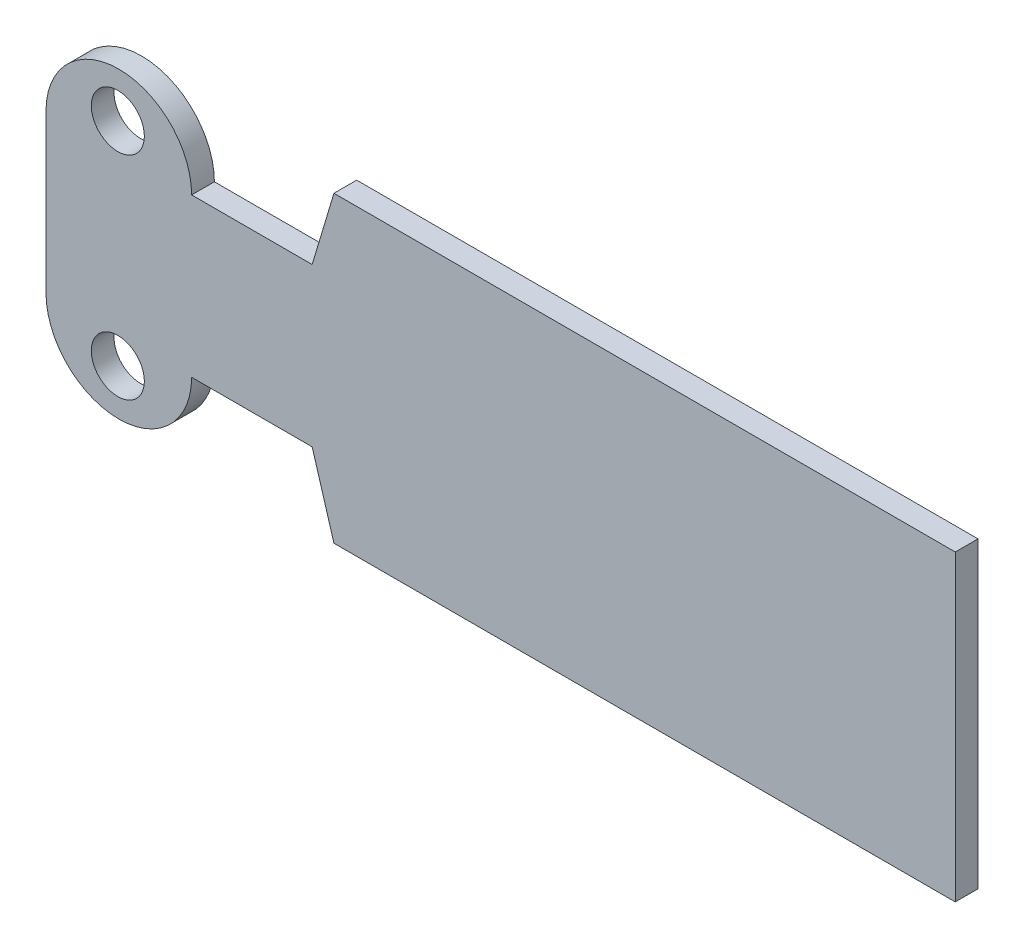
from build123d import *

# Parameters (mm, degrees)
SKETCH1_R           = 1.75
BOSS_EXTRUDE1_DEPTH = 1.5


with BuildPart() as part:
    # Sketch1 → Boss-Extrude1 (new body)
    # profile 1 of 3: a face of its own
    with BuildSketch(Plane.XY):
        Polygon((44, 0), (0, 0), (1.563260572, -5.210868574), (3, -10), (44, -10), align=None)
    # profile 2 of 3: a face of its own
    with BuildSketch(Plane.XY):
        Polygon((1.563260572, 5.210868574), (0, 0), (44, 0), (44, 10), (3, 10), align=None)
    # profile 3 of 3: a face of its own
    with BuildSketch(Plane.XY):
        with BuildLine():
            Line((1.563260572, -5.210868574), (0, 0))
            Line((0, 0), (1.563260572, 5.210868574))
            Line((1.563260572, 5.210868574), (-6.388542044, 5.210868574))
            ThreePointArc((-6.388542044, 5.210868574), (-11.194271022, 10), (-16, 5.210868574))
            Line((-16, 5.210868574), (-16, -5.210868574))
            ThreePointArc((-16, -5.210868574), (-11.194271022, -10), (-6.388542044, -5.210868574))
            Line((-6.388542044, -5.210868574), (1.563260572, -5.210868574))
        make_face()
        with Locations((-11.260632468, -7)):
            Circle(SKETCH1_R, mode=Mode.SUBTRACT)
        with Locations((-11.260632468, 7)):
            Circle(SKETCH1_R, mode=Mode.SUBTRACT)
    extrude(amount=BOSS_EXTRUDE1_DEPTH)


solid = part.part
